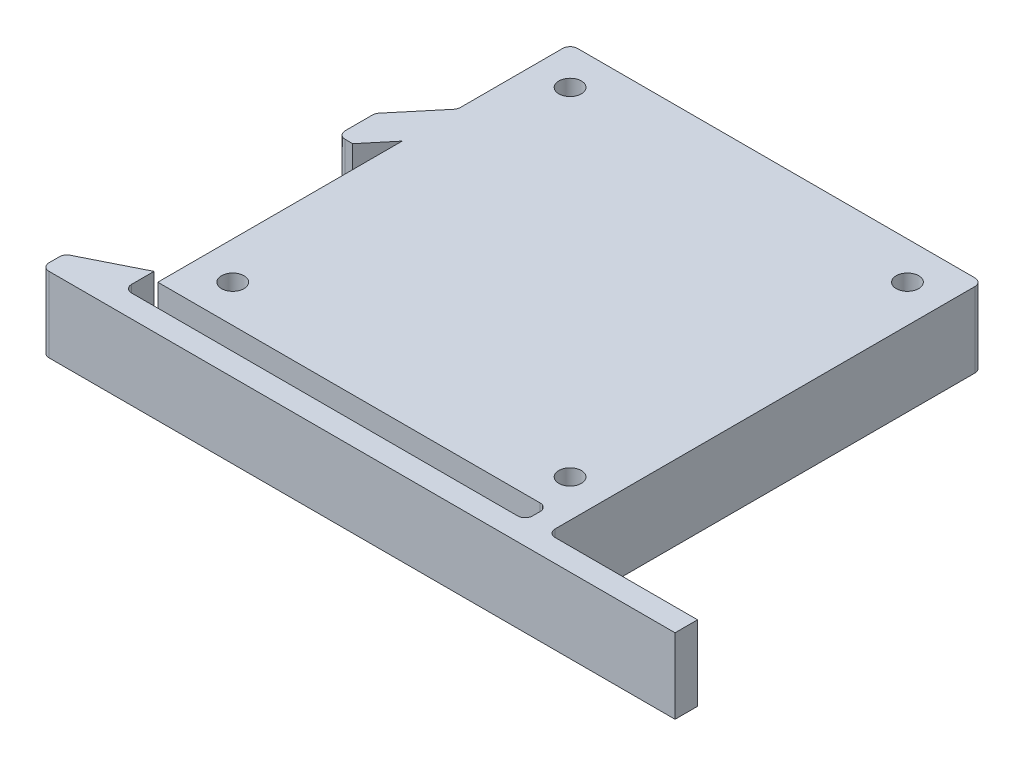
from build123d import *

# Parameters (mm, degrees)
SKETCH1_R           = 1.5
BOSS_EXTRUDE1_DEPTH = 10


with BuildPart() as part:
    # Sketch1 → Boss-Extrude1 (new body)
    with BuildSketch(Plane(origin=(0, 0, 0), x_dir=(1, 0, 0), z_dir=(0, 1, 0))):
        with BuildLine():
            Line((55, 4), (55, 60))
            ThreePointArc((55, 60), (54.707106781, 60.707106781), (54, 61))
            Line((54, 61), (1, 61))
            ThreePointArc((1, 61), (0.292893219, 60.707106781), (0, 60))
            Line((0, 60), (0, 46.362049935))
            ThreePointArc((0, 46.362049935), (-0.059728422, 46.021624671), (-0.23177872, 45.721865536))
            Line((-0.23177872, 45.721865536), (-4.76822128, 40.278134464))
            ThreePointArc((-4.76822128, 40.278134464), (-4.940271578, 39.978375329), (-5, 39.637950065))
            Line((-5, 39.637950065), (-5, 36))
            ThreePointArc((-5, 36), (-4.707106781, 35.292893219), (-4, 35))
            Line((-4, 35), (-3, 35))
            Line((-3, 35), (0, 38.6))
            Line((0, 38.6), (0, 6))
            Line((0, 6), (51, 6))
            ThreePointArc((51, 6), (51.707106781, 5.707106781), (52, 5))
            Line((52, 5), (52, 4))
            ThreePointArc((52, 4), (51.707106781, 3.292893219), (51, 3))
            Line((51, 3), (-0.5, 3))
            ThreePointArc((-0.5, 3), (-1.207106781, 3.292893219), (-1.5, 4))
            Line((-1.5, 4), (-1.5, 7))
            Line((-1.5, 7), (-8.947213595, 3.276393202))
            ThreePointArc((-8.947213595, 3.276393202), (-9.350650808, 2.907697123), (-9.5, 2.381966011))
            Line((-9.5, 2.381966011), (-9.5, 1))
            ThreePointArc((-9.5, 1), (-9.207106781, 0.292893219), (-8.5, 0))
            Line((-8.5, 0), (75, 0))
            Line((75, 0), (75, 3))
            Line((75, 3), (56, 3))
            ThreePointArc((56, 3), (55.292893219, 3.292893219), (55, 4))
        make_face()
        with Locations(Location((5, 56, 0), (0, 0, 270))):
            Circle(SKETCH1_R, mode=Mode.SUBTRACT)
        with Locations(Location((50, 56, 0), (0, 0, 270))):
            Circle(SKETCH1_R, mode=Mode.SUBTRACT)
        with Locations(Location((5, 11, 0), (0, 0, 270))):
            Circle(SKETCH1_R, mode=Mode.SUBTRACT)
        with Locations(Location((50, 11, 0), (0, 0, 270))):
            Circle(SKETCH1_R, mode=Mode.SUBTRACT)
    extrude(amount=BOSS_EXTRUDE1_DEPTH)


solid = part.part
